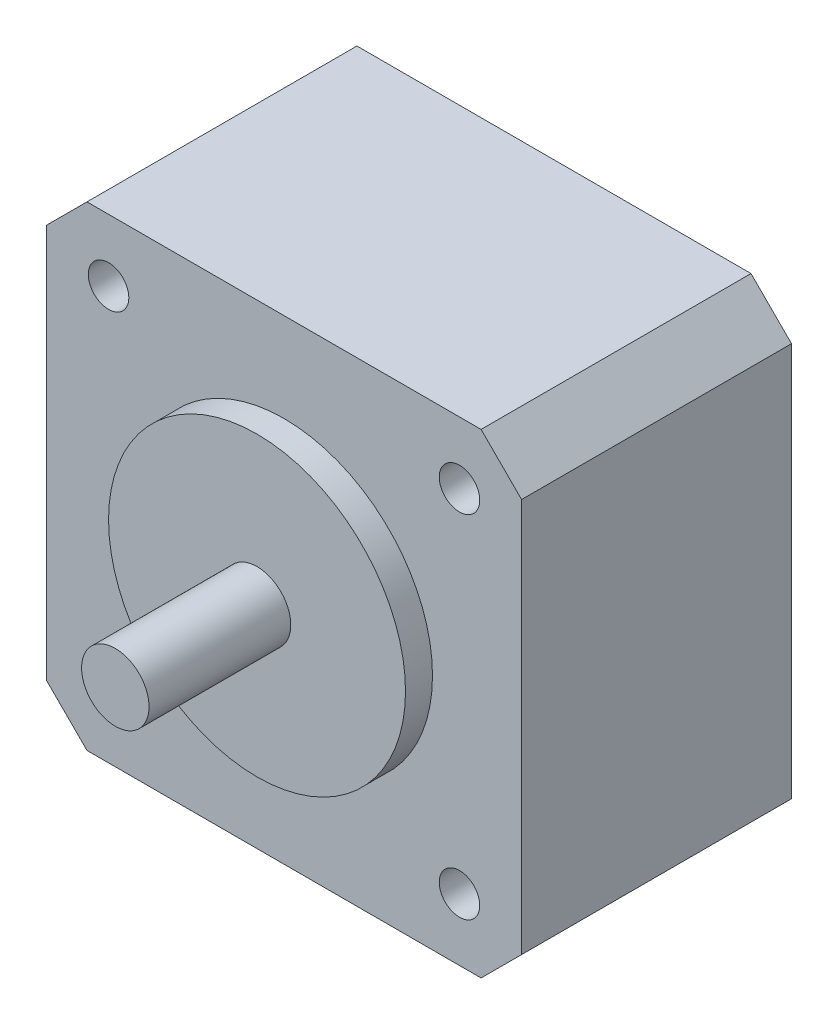
from build123d import *

# Parameters (mm, degrees)
SKETCH1_W           = 35.2
SKETCH1_H           = 35.2
BOSS_EXTRUDE1_DEPTH = 20
SKETCH2_R           = 11
BOSS_EXTRUDE2_DEPTH = 2
SKETCH3_R           = 2.5
BOSS_EXTRUDE3_DEPTH = 10.5
SKETCH4_R           = 1.5
CUT_EXTRUDE1_DEPTH  = 4.5
CHAMFER1_SIZE       = 3


with BuildPart() as part:
    # Sketch1 → Boss-Extrude1 (new body)
    with BuildSketch(Plane.XY):
        Rectangle(SKETCH1_W, SKETCH1_H)
    extrude(amount=BOSS_EXTRUDE1_DEPTH)

    # Sketch2 → Boss-Extrude2 (add)
    with BuildSketch(Plane.XY.offset(20)):
        Circle(SKETCH2_R)
    extrude(amount=BOSS_EXTRUDE2_DEPTH)

    # Sketch3 → Boss-Extrude3 (add)
    with BuildSketch(Plane.XY.offset(22)):
        with Locations(Location((0, 0, 0), (0, 0, 180))):
            Circle(SKETCH3_R)
    extrude(amount=BOSS_EXTRUDE3_DEPTH)

    # Sketch4 → Cut-Extrude1 (cut)
    with BuildSketch(Plane.XY.offset(20)):
        with Locations((13, 13)):
            Circle(SKETCH4_R)
        with Locations((13, -13)):
            Circle(SKETCH4_R)
        with Locations((-13, -13)):
            Circle(SKETCH4_R)
        with Locations((-13, 13)):
            Circle(SKETCH4_R)
    extrude(amount=-CUT_EXTRUDE1_DEPTH, mode=Mode.SUBTRACT)

    # Chamfer1
    chamfer1_edges = [part.edges().sort_by_distance(p)[0] for p in [
        (17.6, -17.6, 10),
        (-17.6, -17.6, 10),
        (-17.6, 17.6, 10),
        (17.6, 17.6, 10),
    ]]
    chamfer(chamfer1_edges, length=CHAMFER1_SIZE)


solid = part.part
